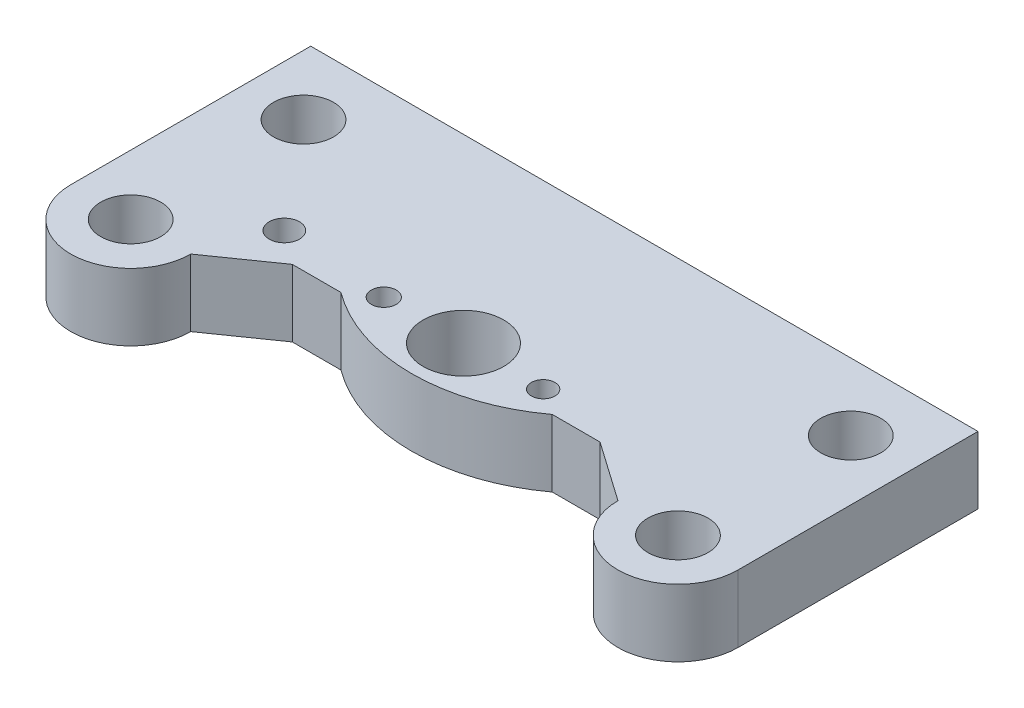
from build123d import *

# Parameters (mm, degrees)
SKETCH1_R           = 3.96875
SKETCH1_R_2         = 2
SKETCH1_R_3         = 1.651
SKETCH1_R_4         = 1.559587107
SKETCH1_R_5         = 5.334
BOSS_EXTRUDE1_DEPTH = 8.89


with BuildPart() as part:
    # Sketch1 → Boss-Extrude1 (new body)
    with BuildSketch(Plane(origin=(0, 0, 0), x_dir=(1, 0, 0), z_dir=(0, 1, 0))):
        with BuildLine():
            Line((80.3275, 31.75), (-7.9375, 31.75))
            Line((-7.9375, 31.75), (-7.9375, 13.97))
            Line((-7.9375, 13.97), (-7.9375, 0))
            ThreePointArc((-7.9375, 0), (0, -7.9375), (7.9375, 0))
            Line((7.9375, 0), (15.843955531, 5.536159764))
            Line((15.843955531, 5.536159764), (22.275753266, 5.536159764))
            ThreePointArc((22.275753266, 5.536159764), (36.248751472, 0.907685249), (50.221749679, 5.536159764))
            Line((50.221749679, 5.536159764), (56.546044469, 5.536159764))
            Line((56.546044469, 5.536159764), (64.4525, 0))
            ThreePointArc((64.4525, 0), (72.39, -7.9375), (80.3275, 0))
            Line((80.3275, 0), (80.3275, 13.97))
            Line((80.3275, 13.97), (80.3275, 31.75))
        make_face()
        with Locations(Location((0, 0, 0), (0, 0, 270))):
            Circle(SKETCH1_R, mode=Mode.SUBTRACT)
        with Locations(Location((72.39, 0, 0), (0, 0, 270))):
            Circle(SKETCH1_R, mode=Mode.SUBTRACT)
        with Locations(Location((72.39, 22.86, 0), (0, 0, 270))):
            Circle(SKETCH1_R, mode=Mode.SUBTRACT)
        with Locations(Location((0, 22.86, 0), (0, 0, 270))):
            Circle(SKETCH1_R, mode=Mode.SUBTRACT)
        with Locations(Location((11.43, 8.89, 0), (0, 0, 270))):
            Circle(SKETCH1_R_2, mode=Mode.SUBTRACT)
        with Locations(Location((25.654, 7.822159764, 0), (0, 0, 270))):
            Circle(SKETCH1_R_3, mode=Mode.SUBTRACT)
        with Locations(Location((46.736, 7.822159764, 0), (0, 0, 270))):
            Circle(SKETCH1_R_4, mode=Mode.SUBTRACT)
        with Locations(Location((36.195, 7.822159764, 0), (0, 0, 270))):
            Circle(SKETCH1_R_5, mode=Mode.SUBTRACT)
    extrude(amount=-BOSS_EXTRUDE1_DEPTH)


solid = part.part
